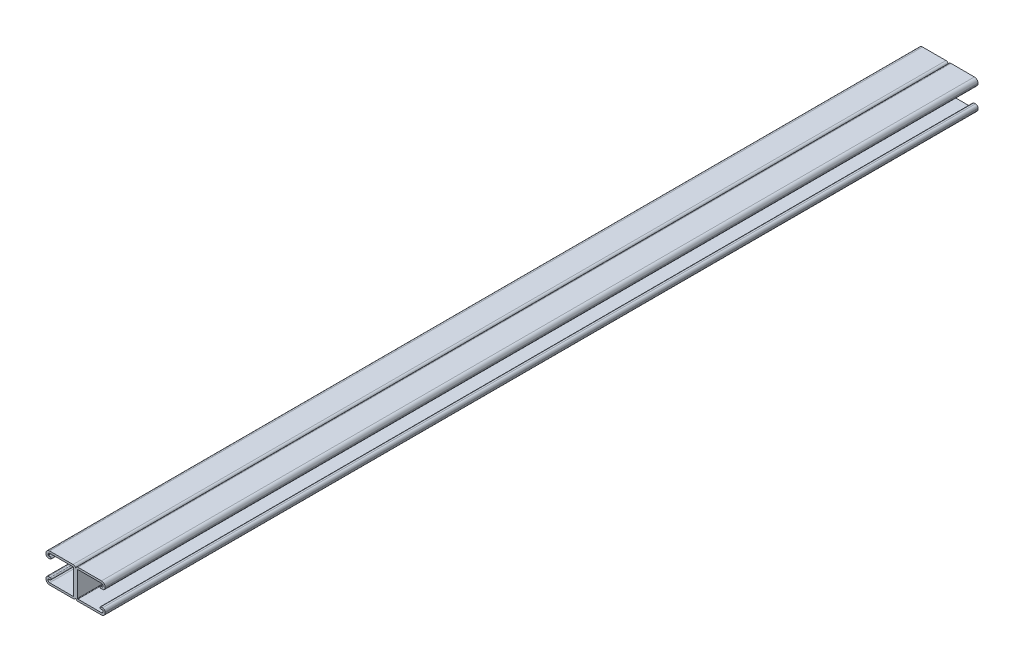
from build123d import *

# Parameters (mm, degrees)
BOSS_EXTRUDE1_DEPTH = 1219.2


with BuildPart() as part:
    # Sketch1 → Boss-Extrude1 (new body)
    with BuildSketch(Plane.XY):
        with BuildLine():
            Line((-36.22675, 20.6375), (-3.46075, 20.6375))
            ThreePointArc((-3.46075, 20.6375), (-1.013630207, 19.623869793), (0, 17.17675))
            Line((0, 17.17675), (0, -17.17675))
            ThreePointArc((0, -17.17675), (-1.013630207, -19.623869793), (-3.46075, -20.6375))
            Line((-3.46075, -20.6375), (-36.22675, -20.6375))
            ThreePointArc((-36.22675, -20.6375), (-39.796401808, -19.158901808), (-41.275, -15.58925))
            Line((-41.275, -15.58925), (-41.275, -14.57325))
            ThreePointArc((-41.275, -14.57325), (-40.261369793, -12.126130207), (-37.81425, -11.1125))
            Line((-37.81425, -11.1125), (-35.5346, -11.1125))
            ThreePointArc((-35.5346, -11.1125), (-34.1376, -12.5095), (-35.5346, -13.9065))
            Line((-35.5346, -13.9065), (-37.81425, -13.9065))
            ThreePointArc((-37.81425, -13.9065), (-38.285713446, -14.101786554), (-38.481, -14.57325))
            Line((-38.481, -14.57325), (-38.481, -15.58925))
            ThreePointArc((-38.481, -15.58925), (-37.820745461, -17.183245461), (-36.22675, -17.8435))
            Line((-36.22675, -17.8435), (-3.46075, -17.8435))
            ThreePointArc((-3.46075, -17.8435), (-2.989286554, -17.648213446), (-2.794, -17.17675))
            Line((-2.794, -17.17675), (-2.794, 17.17675))
            ThreePointArc((-2.794, 17.17675), (-2.989286554, 17.648213446), (-3.46075, 17.8435))
            Line((-3.46075, 17.8435), (-36.22675, 17.8435))
            ThreePointArc((-36.22675, 17.8435), (-37.820745461, 17.183245461), (-38.481, 15.58925))
            Line((-38.481, 15.58925), (-38.481, 14.57325))
            ThreePointArc((-38.481, 14.57325), (-38.285713446, 14.101786554), (-37.81425, 13.9065))
            Line((-37.81425, 13.9065), (-35.5346, 13.9065))
            ThreePointArc((-35.5346, 13.9065), (-34.1376, 12.5095), (-35.5346, 11.1125))
            Line((-35.5346, 11.1125), (-37.81425, 11.1125))
            ThreePointArc((-37.81425, 11.1125), (-40.261369793, 12.126130207), (-41.275, 14.57325))
            Line((-41.275, 14.57325), (-41.275, 15.58925))
            ThreePointArc((-41.275, 15.58925), (-39.796401808, 19.158901808), (-36.22675, 20.6375))
        make_face()
    extrude(amount=-BOSS_EXTRUDE1_DEPTH)


with BuildPart() as body_2:
    # Mirror1: mirrored copy
    add(part.part.mirror(Plane(origin=(0, 17.17675, -1219.2), x_dir=(0, 0, 1), z_dir=(1, 0, 0))))

    # Combine1: union part
    add(part.part)


solid = body_2.part
